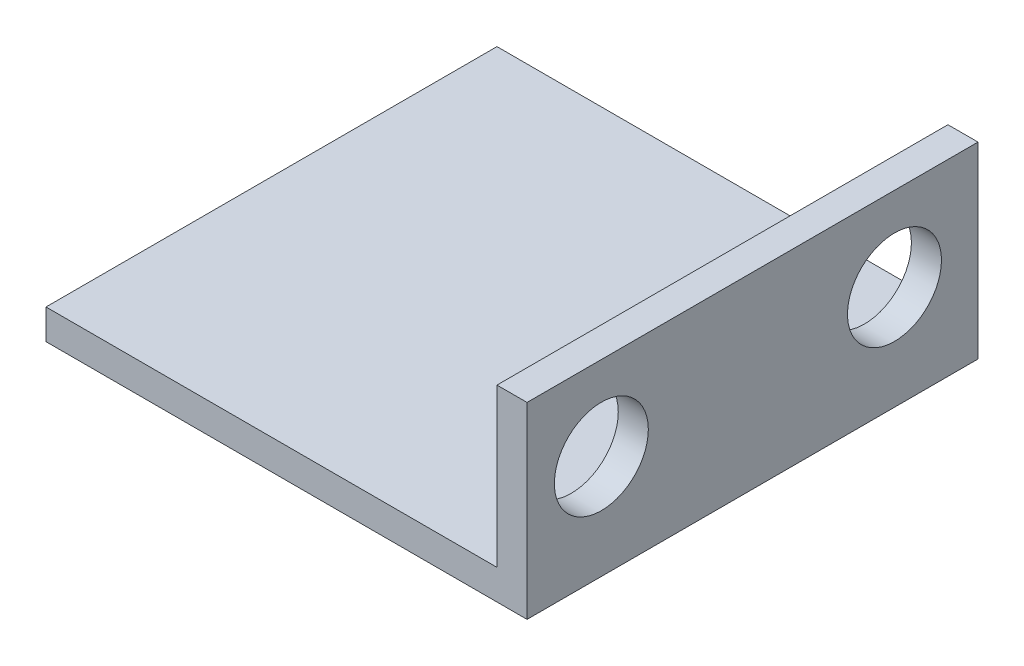
from build123d import *

# Parameters (mm, degrees)
SKETCH_1_W          = 120
SKETCH_1_H          = 120
EXTRUDE_1_DEPTH     = 8
SKETCH_2_W          = 120
SKETCH_2_H          = 50
EXTRUDE_2_DEPTH     = 8
SKETCH_3_R          = 12.5
CUT_EXTRUDE_1_DEPTH = 8
SKETCH_4_R          = 55
CUT_EXTRUDE_2_DEPTH = 0.1


with BuildPart() as part:
    # 草图1 → 凸台-拉伸1 (new body)
    with BuildSketch(Plane(origin=(0, 0, 0), x_dir=(1, 0, 0), z_dir=(0, 1, 0))):
        Rectangle(SKETCH_1_W, SKETCH_1_H)
    extrude(amount=EXTRUDE_1_DEPTH)

    # 草图2 → 凸台-拉伸2 (add)
    with BuildSketch(Plane(origin=(60, 0, 0), x_dir=(0, 0, -1), z_dir=(1, 0, 0))):
        with Locations((0, 25)):
            Rectangle(SKETCH_2_W, SKETCH_2_H)
    extrude(amount=EXTRUDE_2_DEPTH)

    # 草图3 → 切除-拉伸1 (cut)
    with BuildSketch(Plane(origin=(68, 0, 0), x_dir=(0, 0, -1), z_dir=(1, 0, 0))):
        with Locations((-40.221925454, 27.667787736)):
            Circle(SKETCH_3_R)
        with Locations((37.778074521, 27.665810834)):
            Circle(SKETCH_3_R)
    extrude(amount=-CUT_EXTRUDE_1_DEPTH, mode=Mode.SUBTRACT)

    # 草图4 → 切除-拉伸2 (cut)
    with BuildSketch(Plane.XZ):
        with Locations(Location((0, 0, 0), (0, 0, 270))):
            Circle(SKETCH_4_R)
    extrude(amount=-CUT_EXTRUDE_2_DEPTH, mode=Mode.SUBTRACT)


solid = part.part
